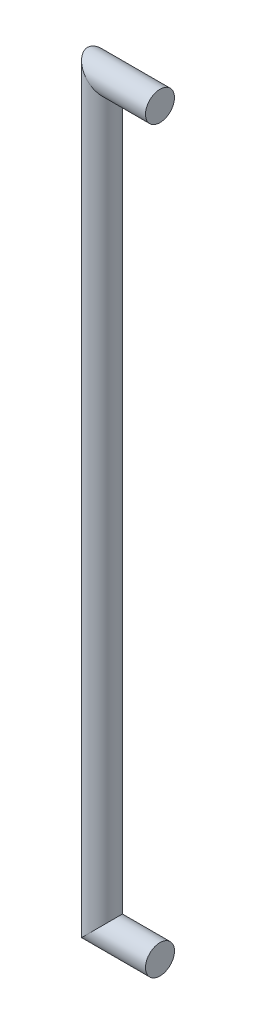
from build123d import *

# Parameters (mm, degrees)
SWEEP1_PROFILE_R = 5


with BuildPart() as part:
    # Sweep1: sweep along a path in Sketch1
    with BuildLine(Plane.XY) as sweep1_path:
        Line((0, 0), (-20, 0))
        Line((-20, 0), (-20, -255))
        Line((-20, -255), (0, -255))
    # Sweep1 profile (on start of the path) → Sweep1 (sweep)
    with BuildSketch(Plane(origin=(0, 0, 0), x_dir=(0, -1, 0), z_dir=(-1, 0, 0))):
        Circle(SWEEP1_PROFILE_R)
    sweep(path=sweep1_path.line, transition=Transition.RIGHT)


solid = part.part
